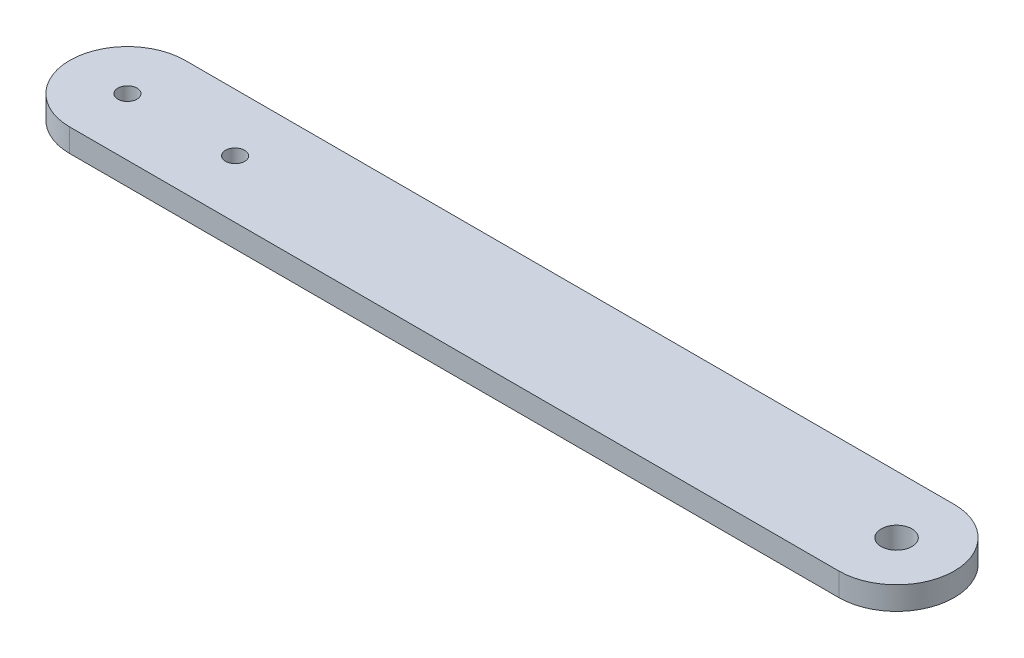
from build123d import *

# Parameters (mm, degrees)
SKETCH1_R           = 2
SKETCH1_R_2         = 1.25
BOSS_EXTRUDE1_DEPTH = 3


with BuildPart() as part:
    # Sketch1 → Boss-Extrude1 (new body)
    with BuildSketch(Plane(origin=(0, 0, 0), x_dir=(1, 0, 0), z_dir=(0, 1, 0))):
        with BuildLine():
            Line((0, 7.5), (100, 7.5))
            ThreePointArc((100, 7.5), (107.5, 0), (100, -7.5))
            Line((100, -7.5), (0, -7.5))
            ThreePointArc((0, -7.5), (-7.5, 0), (0, 7.5))
        make_face()
        with Locations(Location((100, 0, 0), (0, 0, 270))):
            Circle(SKETCH1_R, mode=Mode.SUBTRACT)
        with Locations(Location((0, 0, 0), (0, 0, 270))):
            Circle(SKETCH1_R_2, mode=Mode.SUBTRACT)
        with Locations(Location((14, 0, 0), (0, 0, 270))):
            Circle(SKETCH1_R_2, mode=Mode.SUBTRACT)
    extrude(amount=BOSS_EXTRUDE1_DEPTH)


solid = part.part
